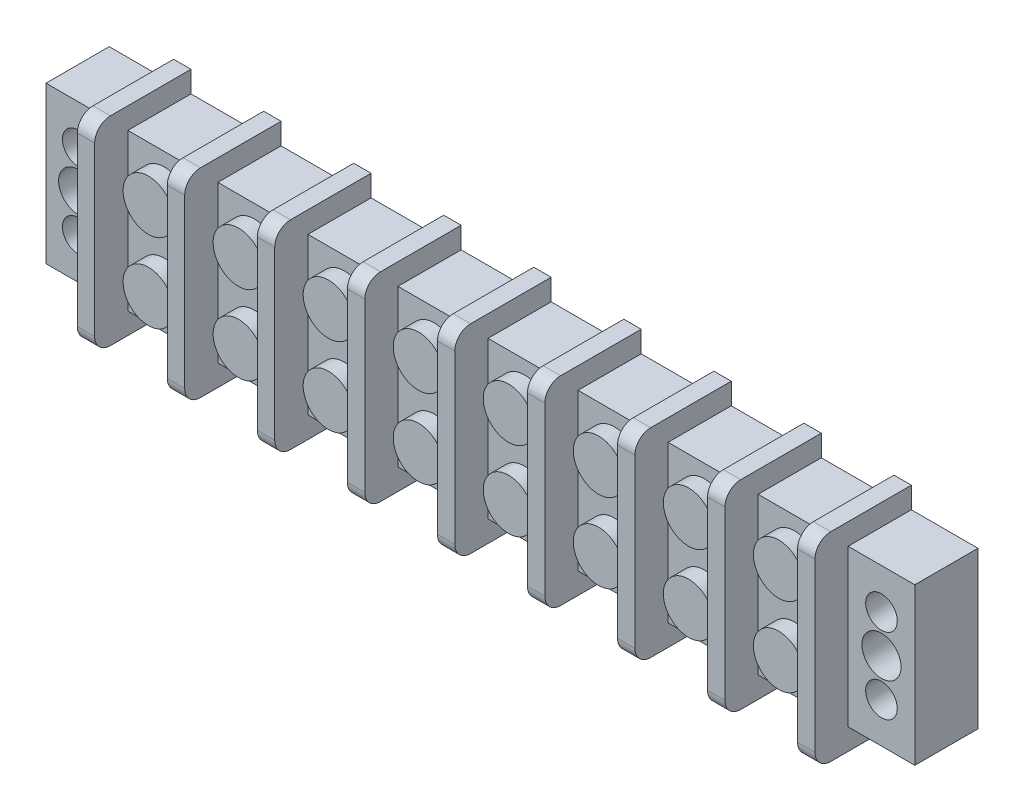
from build123d import *

# Parameters (mm, degrees)
SKETCH1_W           = 139.7
SKETCH1_H           = 25.146
BOSS_EXTRUDE1_DEPTH = 10.16
SKETCH3_W           = 2.794
SKETCH3_H           = 32.004
BOSS_EXTRUDE2_DEPTH = 15.494
FILLET1_R           = 2.54
SKETCH4_R           = 4.064
BOSS_EXTRUDE3_DEPTH = 2.54
SKETCH5_R           = 2.54
SKETCH5_R_2         = 3.1496
CUT_EXTRUDE1_DEPTH  = 10.16


with BuildPart() as part:
    # Sketch1 → Boss-Extrude1 (new body)
    with BuildSketch(Plane.XY):
        with Locations((69.85, 12.573)):
            Rectangle(SKETCH1_W, SKETCH1_H)
    extrude(amount=BOSS_EXTRUDE1_DEPTH)

    # Sketch3 → Boss-Extrude2 (add)
    with BuildSketch(Plane.XY):
        with Locations((98.6282, 12.573)):
            Rectangle(SKETCH3_W, SKETCH3_H)
        with Locations((127.5842, 12.573)):
            Rectangle(SKETCH3_W, SKETCH3_H)
        with Locations((113.1062, 12.573)):
            Rectangle(SKETCH3_W, SKETCH3_H)
        with Locations((84.1502, 12.573)):
            Rectangle(SKETCH3_W, SKETCH3_H)
        with Locations((69.6722, 12.573)):
            Rectangle(SKETCH3_W, SKETCH3_H)
        with Locations((55.1942, 12.573)):
            Rectangle(SKETCH3_W, SKETCH3_H)
        with Locations((40.7162, 12.573)):
            Rectangle(SKETCH3_W, SKETCH3_H)
        with Locations((26.2382, 12.573)):
            Rectangle(SKETCH3_W, SKETCH3_H)
        with Locations((11.7602, 12.573)):
            Rectangle(SKETCH3_W, SKETCH3_H)
    extrude(amount=BOSS_EXTRUDE2_DEPTH)

    # Fillet1
    fillet1_edges = [part.edges().sort_by_distance(p)[0] for p in [
        (69.6722, -3.429, 15.494),
        (69.6722, 28.575, 15.494),
        (55.1942, -3.429, 15.494),
        (55.1942, 28.575, 15.494),
        (40.7162, -3.429, 15.494),
        (40.7162, 28.575, 15.494),
        (26.2382, -3.429, 15.494),
        (26.2382, 28.575, 15.494),
        (11.7602, -3.429, 15.494),
        (11.7602, 28.575, 15.494),
        (127.5842, -3.429, 15.494),
        (127.5842, 28.575, 15.494),
        (113.1062, -3.429, 15.494),
        (113.1062, 28.575, 15.494),
        (98.6282, -3.429, 15.494),
        (98.6282, 28.575, 15.494),
        (84.1502, -3.429, 15.494),
        (84.1502, 28.575, 15.494),
    ]]
    fillet(fillet1_edges, radius=FILLET1_R)

    # Sketch4 → Boss-Extrude3 (add)
    with BuildSketch(Plane.XY.offset(10.16)):
        with Locations((18.9992, 18.923)):
            Circle(SKETCH4_R)
        with Locations((18.9992, 6.223)):
            Circle(SKETCH4_R)
        with Locations((47.9552, 18.923)):
            Circle(SKETCH4_R)
        with Locations((47.9552, 6.223)):
            Circle(SKETCH4_R)
        with Locations((33.4772, 18.923)):
            Circle(SKETCH4_R)
        with Locations((33.4772, 6.223)):
            Circle(SKETCH4_R)
        with Locations((62.4332, 18.923)):
            Circle(SKETCH4_R)
        with Locations((62.4332, 6.223)):
            Circle(SKETCH4_R)
        with Locations((76.9112, 18.923)):
            Circle(SKETCH4_R)
        with Locations((76.9112, 6.223)):
            Circle(SKETCH4_R)
        with Locations((91.3892, 18.923)):
            Circle(SKETCH4_R)
        with Locations((91.3892, 6.223)):
            Circle(SKETCH4_R)
        with Locations((105.8672, 18.923)):
            Circle(SKETCH4_R)
        with Locations((105.8672, 6.223)):
            Circle(SKETCH4_R)
        with Locations((120.3452, 18.923)):
            Circle(SKETCH4_R)
        with Locations((120.3452, 6.223)):
            Circle(SKETCH4_R)
    extrude(amount=BOSS_EXTRUDE3_DEPTH)

    # Sketch5 → Cut-Extrude1 (cut)
    with BuildSketch(Plane.XY.offset(10.16)):
        with Locations((5.1816, 18.669)):
            Circle(SKETCH5_R)
        with Locations((134.3406, 18.669)):
            Circle(SKETCH5_R)
        with Locations((134.3406, 12.573)):
            Circle(SKETCH5_R_2)
        with Locations((5.1816, 6.477)):
            Circle(SKETCH5_R)
        with Locations((134.3406, 6.477)):
            Circle(SKETCH5_R)
        with Locations((5.1816, 12.573)):
            Circle(SKETCH5_R_2)
    extrude(amount=-CUT_EXTRUDE1_DEPTH, mode=Mode.SUBTRACT)


solid = part.part
